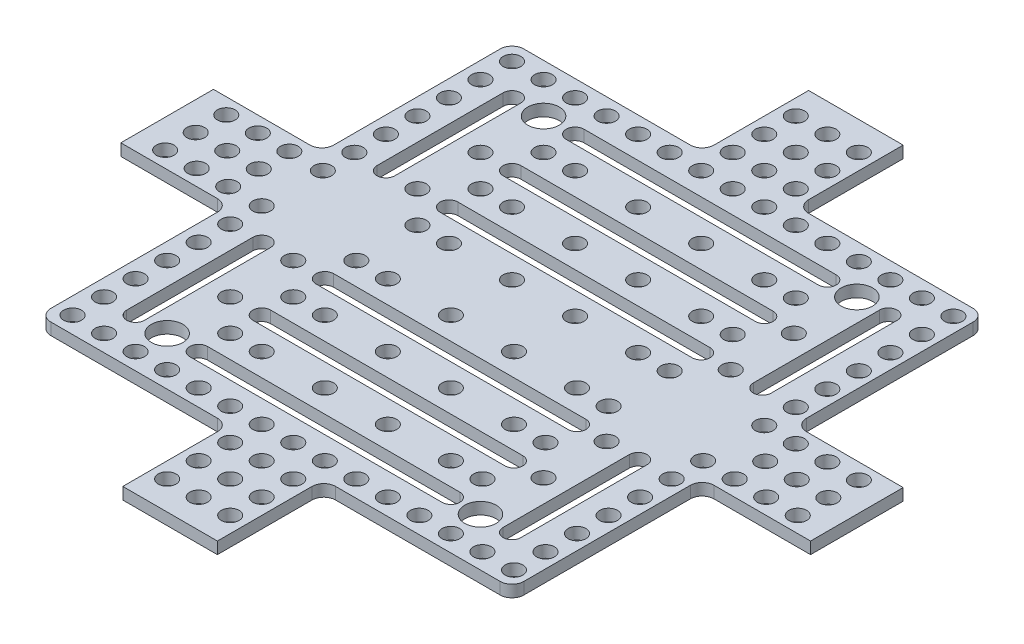
from build123d import *

# Parameters (mm, degrees)
SKETCH_1_R      = 2.25
SKETCH_1_R_2    = 4
EXTRUDE_1_DEPTH = 3
FILLET_1_R      = 3


with BuildPart() as part:
    # 草图1 → 凸台-拉伸1 (new body)
    with BuildSketch(Plane(origin=(0, 0, 0), x_dir=(1, 0, 0), z_dir=(0, 1, 0))):
        Polygon((-60, -60), (-11.75, -60), (-11.75, -87), (12.25, -87), (12.25, -60), (60, -60), (60, -11.75), (87.5, -11.75), (87.5, 11.75), (60, 11.75), (60, 60), (12.25, 60), (12.25, 87), (-11.75, 87), (-11.75, 60), (-60, 60), (-60, 11.75), (-87.5, 11.75), (-87.5, -11.75), (-60, -11.75), align=None)
        with Locations(Location((-55.75, -55.75, 0), (0, 0, 270))):
            Circle(SKETCH_1_R, mode=Mode.SUBTRACT)
        with Locations(Location((-47.75, -55.75, 0), (0, 0, 270))):
            Circle(SKETCH_1_R, mode=Mode.SUBTRACT)
        with Locations(Location((-39.75, -55.75, 0), (0, 0, 270))):
            Circle(SKETCH_1_R, mode=Mode.SUBTRACT)
        with Locations(Location((-31.75, -55.75, 0), (0, 0, 270))):
            Circle(SKETCH_1_R, mode=Mode.SUBTRACT)
        with Locations(Location((-23.75, -55.75, 0), (0, 0, 270))):
            Circle(SKETCH_1_R, mode=Mode.SUBTRACT)
        with Locations(Location((-15.75, -55.75, 0), (0, 0, 270))):
            Circle(SKETCH_1_R, mode=Mode.SUBTRACT)
        with Locations(Location((-7.75, -55.75, 0), (0, 0, 270))):
            Circle(SKETCH_1_R, mode=Mode.SUBTRACT)
        with Locations(Location((0.25, -55.75, 0), (0, 0, 270))):
            Circle(SKETCH_1_R, mode=Mode.SUBTRACT)
        with Locations(Location((8.25, -55.75, 0), (0, 0, 270))):
            Circle(SKETCH_1_R, mode=Mode.SUBTRACT)
        with Locations(Location((16.25, -55.75, 0), (0, 0, 270))):
            Circle(SKETCH_1_R, mode=Mode.SUBTRACT)
        with Locations(Location((24.25, -55.75, 0), (0, 0, 270))):
            Circle(SKETCH_1_R, mode=Mode.SUBTRACT)
        with Locations(Location((32.25, -55.75, 0), (0, 0, 270))):
            Circle(SKETCH_1_R, mode=Mode.SUBTRACT)
        with Locations(Location((40.25, -55.75, 0), (0, 0, 270))):
            Circle(SKETCH_1_R, mode=Mode.SUBTRACT)
        with Locations(Location((48.25, -55.75, 0), (0, 0, 270))):
            Circle(SKETCH_1_R, mode=Mode.SUBTRACT)
        with Locations(Location((56.25, -55.75, 0), (0, 0, 270))):
            Circle(SKETCH_1_R, mode=Mode.SUBTRACT)
        with Locations(Location((-55.75, -47.75, 0), (0, 0, 270))):
            Circle(SKETCH_1_R, mode=Mode.SUBTRACT)
        with Locations(Location((-55.75, -39.75, 0), (0, 0, 270))):
            Circle(SKETCH_1_R, mode=Mode.SUBTRACT)
        with Locations(Location((-55.75, -31.75, 0), (0, 0, 270))):
            Circle(SKETCH_1_R, mode=Mode.SUBTRACT)
        with Locations(Location((-55.75, -23.75, 0), (0, 0, 270))):
            Circle(SKETCH_1_R, mode=Mode.SUBTRACT)
        with Locations(Location((-55.75, -15.75, 0), (0, 0, 270))):
            Circle(SKETCH_1_R, mode=Mode.SUBTRACT)
        with Locations(Location((-55.75, -7.75, 0), (0, 0, 270))):
            Circle(SKETCH_1_R, mode=Mode.SUBTRACT)
        with Locations(Location((-39.75, -47.75, 0), (0, 0, 270))):
            Circle(SKETCH_1_R_2, mode=Mode.SUBTRACT)
        with Locations(Location((39.75, -47.75, 0), (0, 0, 90))):
            Circle(SKETCH_1_R_2, mode=Mode.SUBTRACT)
        with Locations(Location((56.25, -47.75, 0), (0, 0, 270))):
            Circle(SKETCH_1_R, mode=Mode.SUBTRACT)
        with Locations(Location((56.25, -39.75, 0), (0, 0, 270))):
            Circle(SKETCH_1_R, mode=Mode.SUBTRACT)
        with Locations(Location((56.25, -31.75, 0), (0, 0, 270))):
            Circle(SKETCH_1_R, mode=Mode.SUBTRACT)
        with Locations(Location((56.25, -23.75, 0), (0, 0, 270))):
            Circle(SKETCH_1_R, mode=Mode.SUBTRACT)
        with Locations(Location((56.25, -15.75, 0), (0, 0, 270))):
            Circle(SKETCH_1_R, mode=Mode.SUBTRACT)
        with Locations(Location((56.25, -7.75, 0), (0, 0, 270))):
            Circle(SKETCH_1_R, mode=Mode.SUBTRACT)
        with Locations(Location((-31.75, -39.75, 0), (0, 0, 270))):
            Circle(SKETCH_1_R, mode=Mode.SUBTRACT)
        with Locations(Location((-23.75, -39.75, 0), (0, 0, 270))):
            Circle(SKETCH_1_R, mode=Mode.SUBTRACT)
        with Locations(Location((-7.75, -39.75, 0), (0, 0, 270))):
            Circle(SKETCH_1_R, mode=Mode.SUBTRACT)
        with Locations(Location((8.25, -39.75, 0), (0, 0, 270))):
            Circle(SKETCH_1_R, mode=Mode.SUBTRACT)
        with Locations(Location((24.25, -39.75, 0), (0, 0, 270))):
            Circle(SKETCH_1_R, mode=Mode.SUBTRACT)
        with Locations(Location((32.25, -39.75, 0), (0, 0, 270))):
            Circle(SKETCH_1_R, mode=Mode.SUBTRACT)
        with Locations(Location((-39.75, -31.75, 0), (0, 0, 270))):
            Circle(SKETCH_1_R, mode=Mode.SUBTRACT)
        with Locations(Location((39.75, -31.75, 0), (0, 0, 90))):
            Circle(SKETCH_1_R, mode=Mode.SUBTRACT)
        with Locations(Location((-31.75, -23.75, 0), (0, 0, 270))):
            Circle(SKETCH_1_R, mode=Mode.SUBTRACT)
        with Locations(Location((-23.75, -23.75, 0), (0, 0, 270))):
            Circle(SKETCH_1_R, mode=Mode.SUBTRACT)
        with Locations(Location((-7.75, -23.75, 0), (0, 0, 270))):
            Circle(SKETCH_1_R, mode=Mode.SUBTRACT)
        with Locations(Location((8.25, -23.75, 0), (0, 0, 270))):
            Circle(SKETCH_1_R, mode=Mode.SUBTRACT)
        with Locations(Location((24.25, -23.75, 0), (0, 0, 270))):
            Circle(SKETCH_1_R, mode=Mode.SUBTRACT)
        with Locations(Location((32.25, -23.75, 0), (0, 0, 270))):
            Circle(SKETCH_1_R, mode=Mode.SUBTRACT)
        with Locations(Location((39.75, -15.75, 0), (0, 0, 90))):
            Circle(SKETCH_1_R, mode=Mode.SUBTRACT)
        with Locations(Location((-39.75, -15.75, 0), (0, 0, 270))):
            Circle(SKETCH_1_R, mode=Mode.SUBTRACT)
        with Locations(Location((-31.75, -7.75, 0), (0, 0, 270))):
            Circle(SKETCH_1_R, mode=Mode.SUBTRACT)
        with Locations(Location((-23.75, -7.75, 0), (0, 0, 270))):
            Circle(SKETCH_1_R, mode=Mode.SUBTRACT)
        with Locations(Location((-7.75, -7.75, 0), (0, 0, 270))):
            Circle(SKETCH_1_R, mode=Mode.SUBTRACT)
        with Locations(Location((8.25, -7.75, 0), (0, 0, 270))):
            Circle(SKETCH_1_R, mode=Mode.SUBTRACT)
        with Locations(Location((24.25, -7.75, 0), (0, 0, 270))):
            Circle(SKETCH_1_R, mode=Mode.SUBTRACT)
        with Locations(Location((32.25, -7.75, 0), (0, 0, 270))):
            Circle(SKETCH_1_R, mode=Mode.SUBTRACT)
        with Locations(Location((32.25, 39.75, 0), (0, 0, 90))):
            Circle(SKETCH_1_R, mode=Mode.SUBTRACT)
        with Locations(Location((-31.75, 39.75, 0), (0, 0, 90))):
            Circle(SKETCH_1_R, mode=Mode.SUBTRACT)
        with Locations(Location((-23.75, 39.75, 0), (0, 0, 90))):
            Circle(SKETCH_1_R, mode=Mode.SUBTRACT)
        with Locations(Location((-7.75, 39.75, 0), (0, 0, 90))):
            Circle(SKETCH_1_R, mode=Mode.SUBTRACT)
        with Locations(Location((8.25, 39.75, 0), (0, 0, 90))):
            Circle(SKETCH_1_R, mode=Mode.SUBTRACT)
        with Locations(Location((24.25, 39.75, 0), (0, 0, 90))):
            Circle(SKETCH_1_R, mode=Mode.SUBTRACT)
        with Locations(Location((32.25, 23.75, 0), (0, 0, 90))):
            Circle(SKETCH_1_R, mode=Mode.SUBTRACT)
        with Locations(Location((24.25, 23.75, 0), (0, 0, 90))):
            Circle(SKETCH_1_R, mode=Mode.SUBTRACT)
        with Locations(Location((8.25, 23.75, 0), (0, 0, 90))):
            Circle(SKETCH_1_R, mode=Mode.SUBTRACT)
        with Locations(Location((-7.75, 23.75, 0), (0, 0, 90))):
            Circle(SKETCH_1_R, mode=Mode.SUBTRACT)
        with Locations(Location((-23.75, 23.75, 0), (0, 0, 90))):
            Circle(SKETCH_1_R, mode=Mode.SUBTRACT)
        with Locations(Location((-31.75, 23.75, 0), (0, 0, 90))):
            Circle(SKETCH_1_R, mode=Mode.SUBTRACT)
        with Locations(Location((-39.75, 31.75, 0), (0, 0, 90))):
            Circle(SKETCH_1_R, mode=Mode.SUBTRACT)
        with Locations(Location((-39.75, 47.75, 0), (0, 0, 90))):
            Circle(SKETCH_1_R_2, mode=Mode.SUBTRACT)
        with Locations(Location((-47.75, 55.75, 0), (0, 0, 90))):
            Circle(SKETCH_1_R, mode=Mode.SUBTRACT)
        with Locations(Location((-39.75, 55.75, 0), (0, 0, 90))):
            Circle(SKETCH_1_R, mode=Mode.SUBTRACT)
        with Locations(Location((-31.75, 55.75, 0), (0, 0, 90))):
            Circle(SKETCH_1_R, mode=Mode.SUBTRACT)
        with Locations(Location((-23.75, 55.75, 0), (0, 0, 90))):
            Circle(SKETCH_1_R, mode=Mode.SUBTRACT)
        with Locations(Location((-15.75, 55.75, 0), (0, 0, 90))):
            Circle(SKETCH_1_R, mode=Mode.SUBTRACT)
        with Locations(Location((-7.75, 55.75, 0), (0, 0, 90))):
            Circle(SKETCH_1_R, mode=Mode.SUBTRACT)
        with Locations(Location((0.25, 55.75, 0), (0, 0, 90))):
            Circle(SKETCH_1_R, mode=Mode.SUBTRACT)
        with Locations(Location((32.25, 55.75, 0), (0, 0, 90))):
            Circle(SKETCH_1_R, mode=Mode.SUBTRACT)
        with Locations(Location((24.25, 55.75, 0), (0, 0, 90))):
            Circle(SKETCH_1_R, mode=Mode.SUBTRACT)
        with Locations(Location((8.25, 55.75, 0), (0, 0, 90))):
            Circle(SKETCH_1_R, mode=Mode.SUBTRACT)
        with Locations(Location((16.25, 55.75, 0), (0, 0, 90))):
            Circle(SKETCH_1_R, mode=Mode.SUBTRACT)
        with Locations(Location((39.75, 31.75, 0), (0, 0, 270))):
            Circle(SKETCH_1_R, mode=Mode.SUBTRACT)
        with Locations(Location((39.75, 47.75, 0), (0, 0, 270))):
            Circle(SKETCH_1_R_2, mode=Mode.SUBTRACT)
        with Locations(Location((40.25, 55.75, 0), (0, 0, 90))):
            Circle(SKETCH_1_R, mode=Mode.SUBTRACT)
        with Locations(Location((48.25, 55.75, 0), (0, 0, 90))):
            Circle(SKETCH_1_R, mode=Mode.SUBTRACT)
        with Locations(Location((56.25, 55.75, 0), (0, 0, 90))):
            Circle(SKETCH_1_R, mode=Mode.SUBTRACT)
        with Locations(Location((56.25, 47.75, 0), (0, 0, 90))):
            Circle(SKETCH_1_R, mode=Mode.SUBTRACT)
        with Locations(Location((56.25, 39.75, 0), (0, 0, 90))):
            Circle(SKETCH_1_R, mode=Mode.SUBTRACT)
        with Locations(Location((56.25, 31.75, 0), (0, 0, 90))):
            Circle(SKETCH_1_R, mode=Mode.SUBTRACT)
        with Locations(Location((56.25, 23.75, 0), (0, 0, 90))):
            Circle(SKETCH_1_R, mode=Mode.SUBTRACT)
        with Locations(Location((56.25, 15.75, 0), (0, 0, 90))):
            Circle(SKETCH_1_R, mode=Mode.SUBTRACT)
        with Locations(Location((56.25, 7.75, 0), (0, 0, 90))):
            Circle(SKETCH_1_R, mode=Mode.SUBTRACT)
        with Locations(Location((39.75, 15.75, 0), (0, 0, 270))):
            Circle(SKETCH_1_R, mode=Mode.SUBTRACT)
        with Locations(Location((32.25, 7.75, 0), (0, 0, 90))):
            Circle(SKETCH_1_R, mode=Mode.SUBTRACT)
        with Locations(Location((24.25, 7.75, 0), (0, 0, 90))):
            Circle(SKETCH_1_R, mode=Mode.SUBTRACT)
        with Locations(Location((8.25, 7.75, 0), (0, 0, 90))):
            Circle(SKETCH_1_R, mode=Mode.SUBTRACT)
        with Locations(Location((-7.75, 7.75, 0), (0, 0, 90))):
            Circle(SKETCH_1_R, mode=Mode.SUBTRACT)
        with Locations(Location((-23.75, 7.75, 0), (0, 0, 90))):
            Circle(SKETCH_1_R, mode=Mode.SUBTRACT)
        with Locations(Location((-31.75, 7.75, 0), (0, 0, 90))):
            Circle(SKETCH_1_R, mode=Mode.SUBTRACT)
        with Locations(Location((-39.75, 15.75, 0), (0, 0, 90))):
            Circle(SKETCH_1_R, mode=Mode.SUBTRACT)
        with Locations(Location((-55.75, 55.75, 0), (0, 0, 90))):
            Circle(SKETCH_1_R, mode=Mode.SUBTRACT)
        with Locations(Location((-55.75, 47.75, 0), (0, 0, 90))):
            Circle(SKETCH_1_R, mode=Mode.SUBTRACT)
        with Locations(Location((-55.75, 39.75, 0), (0, 0, 90))):
            Circle(SKETCH_1_R, mode=Mode.SUBTRACT)
        with Locations(Location((-55.75, 31.75, 0), (0, 0, 90))):
            Circle(SKETCH_1_R, mode=Mode.SUBTRACT)
        with Locations(Location((-55.75, 23.75, 0), (0, 0, 90))):
            Circle(SKETCH_1_R, mode=Mode.SUBTRACT)
        with Locations(Location((-55.75, 15.75, 0), (0, 0, 90))):
            Circle(SKETCH_1_R, mode=Mode.SUBTRACT)
        with Locations(Location((-55.75, 7.75, 0), (0, 0, 90))):
            Circle(SKETCH_1_R, mode=Mode.SUBTRACT)
        with Locations(Location((-7.75, -63.75, 0), (0, 0, 270))):
            Circle(SKETCH_1_R, mode=Mode.SUBTRACT)
        with Locations(Location((0.25, -63.75, 0), (0, 0, 270))):
            Circle(SKETCH_1_R, mode=Mode.SUBTRACT)
        with Locations(Location((8.25, -63.75, 0), (0, 0, 270))):
            Circle(SKETCH_1_R, mode=Mode.SUBTRACT)
        with Locations(Location((-7.75, -71.75, 0), (0, 0, 270))):
            Circle(SKETCH_1_R, mode=Mode.SUBTRACT)
        with Locations(Location((0.25, -71.75, 0), (0, 0, 270))):
            Circle(SKETCH_1_R, mode=Mode.SUBTRACT)
        with Locations(Location((8.25, -71.75, 0), (0, 0, 270))):
            Circle(SKETCH_1_R, mode=Mode.SUBTRACT)
        with Locations(Location((-7.75, -79.75, 0), (0, 0, 270))):
            Circle(SKETCH_1_R, mode=Mode.SUBTRACT)
        with Locations(Location((0.25, -79.75, 0), (0, 0, 270))):
            Circle(SKETCH_1_R, mode=Mode.SUBTRACT)
        with Locations(Location((8.25, -79.75, 0), (0, 0, 270))):
            Circle(SKETCH_1_R, mode=Mode.SUBTRACT)
        with Locations(Location((8.25, 79.75, 0), (0, 0, 90))):
            Circle(SKETCH_1_R, mode=Mode.SUBTRACT)
        with Locations(Location((8.25, 71.75, 0), (0, 0, 90))):
            Circle(SKETCH_1_R, mode=Mode.SUBTRACT)
        with Locations(Location((0.25, 71.75, 0), (0, 0, 90))):
            Circle(SKETCH_1_R, mode=Mode.SUBTRACT)
        with Locations(Location((0.25, 79.75, 0), (0, 0, 90))):
            Circle(SKETCH_1_R, mode=Mode.SUBTRACT)
        with Locations(Location((-7.75, 79.75, 0), (0, 0, 90))):
            Circle(SKETCH_1_R, mode=Mode.SUBTRACT)
        with Locations(Location((-7.75, 71.75, 0), (0, 0, 90))):
            Circle(SKETCH_1_R, mode=Mode.SUBTRACT)
        with Locations(Location((-7.75, 63.75, 0), (0, 0, 90))):
            Circle(SKETCH_1_R, mode=Mode.SUBTRACT)
        with Locations(Location((0.25, 63.75, 0), (0, 0, 90))):
            Circle(SKETCH_1_R, mode=Mode.SUBTRACT)
        with Locations(Location((8.25, 63.75, 0), (0, 0, 90))):
            Circle(SKETCH_1_R, mode=Mode.SUBTRACT)
        with Locations(Location((64.25, 7.75, 0), (0, 0, 270))):
            Circle(SKETCH_1_R, mode=Mode.SUBTRACT)
        with Locations(Location((72.25, 7.75, 0), (0, 0, 270))):
            Circle(SKETCH_1_R, mode=Mode.SUBTRACT)
        with Locations(Location((80.25, 7.75, 0), (0, 0, 270))):
            Circle(SKETCH_1_R, mode=Mode.SUBTRACT)
        with Locations(Location((72.25, 0, 0), (0, 0, 270))):
            Circle(SKETCH_1_R, mode=Mode.SUBTRACT)
        with Locations(Location((80.25, 0, 0), (0, 0, 270))):
            Circle(SKETCH_1_R, mode=Mode.SUBTRACT)
        with Locations(Location((72.25, -7.75, 0), (0, 0, 270))):
            Circle(SKETCH_1_R, mode=Mode.SUBTRACT)
        with Locations(Location((80.25, -7.75, 0), (0, 0, 270))):
            Circle(SKETCH_1_R, mode=Mode.SUBTRACT)
        with Locations(Location((64.25, 0, 0), (0, 0, 270))):
            Circle(SKETCH_1_R, mode=Mode.SUBTRACT)
        with Locations(Location((64.25, -7.75, 0), (0, 0, 270))):
            Circle(SKETCH_1_R, mode=Mode.SUBTRACT)
        with Locations(Location((-80.25, -7.75, 0), (0, 0, 90))):
            Circle(SKETCH_1_R, mode=Mode.SUBTRACT)
        with Locations(Location((-72.25, -7.75, 0), (0, 0, 90))):
            Circle(SKETCH_1_R, mode=Mode.SUBTRACT)
        with Locations(Location((-64.25, -7.75, 0), (0, 0, 90))):
            Circle(SKETCH_1_R, mode=Mode.SUBTRACT)
        with Locations(Location((-64.25, 0, 0), (0, 0, 90))):
            Circle(SKETCH_1_R, mode=Mode.SUBTRACT)
        with Locations(Location((-72.25, 0, 0), (0, 0, 90))):
            Circle(SKETCH_1_R, mode=Mode.SUBTRACT)
        with Locations(Location((-80.25, 0, 0), (0, 0, 90))):
            Circle(SKETCH_1_R, mode=Mode.SUBTRACT)
        with Locations(Location((-80.25, 7.75, 0), (0, 0, 90))):
            Circle(SKETCH_1_R, mode=Mode.SUBTRACT)
        with Locations(Location((-72.25, 7.75, 0), (0, 0, 90))):
            Circle(SKETCH_1_R, mode=Mode.SUBTRACT)
        with Locations(Location((-64.25, 7.75, 0), (0, 0, 90))):
            Circle(SKETCH_1_R, mode=Mode.SUBTRACT)
        with BuildLine():
            Line((-45.5, -15.75), (-45.5, -47.75))
            ThreePointArc((-45.5, -47.75), (-47.75, -50), (-50, -47.75))
            Line((-50, -47.75), (-50, -15.75))
            ThreePointArc((-50, -15.75), (-47.75, -13.5), (-45.5, -15.75))
        make_face(mode=Mode.SUBTRACT)
        with BuildLine():
            Line((45.5, -15.75), (45.5, -47.75))
            ThreePointArc((45.5, -47.75), (47.75, -50), (50, -47.75))
            Line((50, -47.75), (50, -15.75))
            ThreePointArc((50, -15.75), (47.75, -13.5), (45.5, -15.75))
        make_face(mode=Mode.SUBTRACT)
        with BuildLine():
            Line((-31.75, -29.5), (32.25, -29.5))
            ThreePointArc((32.25, -29.5), (34.5, -31.75), (32.25, -34))
            Line((32.25, -34), (-31.75, -34))
            ThreePointArc((-31.75, -34), (-34, -31.75), (-31.75, -29.5))
        make_face(mode=Mode.SUBTRACT)
        with BuildLine():
            Line((-31.75, -45.5), (32.25, -45.5))
            ThreePointArc((32.25, -45.5), (34.5, -47.75), (32.25, -50))
            Line((32.25, -50), (-31.75, -50))
            ThreePointArc((-31.75, -50), (-34, -47.75), (-31.75, -45.5))
        make_face(mode=Mode.SUBTRACT)
        with BuildLine():
            Line((-31.75, -13.5), (32.25, -13.5))
            ThreePointArc((32.25, -13.5), (34.5, -15.75), (32.25, -18))
            Line((32.25, -18), (-31.75, -18))
            ThreePointArc((-31.75, -18), (-34, -15.75), (-31.75, -13.5))
        make_face(mode=Mode.SUBTRACT)
        with BuildLine():
            Line((-31.75, 13.5), (32.25, 13.5))
            ThreePointArc((32.25, 13.5), (34.5, 15.75), (32.25, 18))
            Line((32.25, 18), (-31.75, 18))
            ThreePointArc((-31.75, 18), (-34, 15.75), (-31.75, 13.5))
        make_face(mode=Mode.SUBTRACT)
        with BuildLine():
            Line((-31.75, 45.5), (32.25, 45.5))
            ThreePointArc((32.25, 45.5), (34.5, 47.75), (32.25, 50))
            Line((32.25, 50), (-31.75, 50))
            ThreePointArc((-31.75, 50), (-34, 47.75), (-31.75, 45.5))
        make_face(mode=Mode.SUBTRACT)
        with BuildLine():
            Line((-31.75, 29.5), (32.25, 29.5))
            ThreePointArc((32.25, 29.5), (34.5, 31.75), (32.25, 34))
            Line((32.25, 34), (-31.75, 34))
            ThreePointArc((-31.75, 34), (-34, 31.75), (-31.75, 29.5))
        make_face(mode=Mode.SUBTRACT)
        with BuildLine():
            Line((45.5, 15.75), (45.5, 47.75))
            ThreePointArc((45.5, 47.75), (47.75, 50), (50, 47.75))
            Line((50, 47.75), (50, 15.75))
            ThreePointArc((50, 15.75), (47.75, 13.5), (45.5, 15.75))
        make_face(mode=Mode.SUBTRACT)
        with BuildLine():
            Line((-45.5, 15.75), (-45.5, 47.75))
            ThreePointArc((-45.5, 47.75), (-47.75, 50), (-50, 47.75))
            Line((-50, 47.75), (-50, 15.75))
            ThreePointArc((-50, 15.75), (-47.75, 13.5), (-45.5, 15.75))
        make_face(mode=Mode.SUBTRACT)
    extrude(amount=EXTRUDE_1_DEPTH)

    # 圆角1
    fillet_1_edges = [part.edges().sort_by_distance(p)[0] for p in [
        (60, 1.5, -11.75),
        (60, 1.5, 11.75),
        (60, 1.5, 60),
        (12.25, 1.5, 60),
        (-11.75, 1.5, 60),
        (-60, 1.5, 60),
        (-60, 1.5, 11.75),
        (-60, 1.5, -11.75),
        (-60, 1.5, -60),
        (-11.75, 1.5, -60),
        (12.25, 1.5, -60),
        (60, 1.5, -60),
    ]]
    fillet(fillet_1_edges, radius=FILLET_1_R)


solid = part.part
